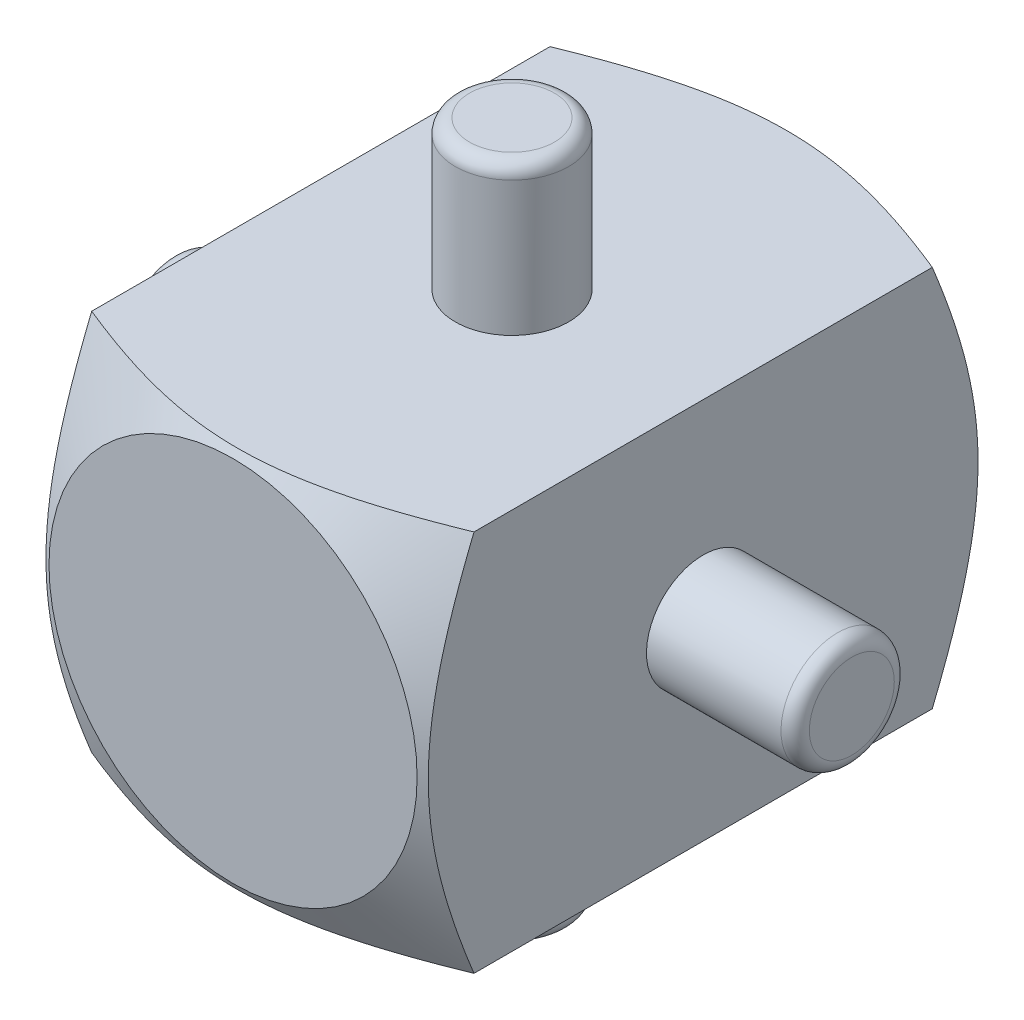
from build123d import *

# Parameters (mm, degrees)
SKETCH1_W           = 13.5
SKETCH1_H           = 13.5
BOSS_EXTRUDE1_DEPTH = 19.7
SKETCH3_R           = 2
BOSS_EXTRUDE2_DEPTH = 12
SKETCH4_R           = 2
BOSS_EXTRUDE3_DEPTH = 12
FILLET1_R           = 0.5


with BuildPart() as part:
    # Sketch1 → Boss-Extrude1 (new body)
    with BuildSketch(Plane.XY):
        Rectangle(SKETCH1_W, SKETCH1_H)
    extrude(amount=BOSS_EXTRUDE1_DEPTH)

    # Sketch2 → Cut-Revolve1 (revolve, cut)
    with BuildSketch(Plane(origin=(0, 0, 0), x_dir=(1, 0, 0), z_dir=(0, 1, 0)), mode=Mode.PRIVATE) as cut_revolve1_sk:
        Polygon((-6.5, 0), (-15.39, 0), (-15.39, -19.7), (-6.5, -19.7), (-12.85, -16.033825791), (-12.85, -3.666174209), align=None)
    revolve(cut_revolve1_sk.sketch.rotate(Axis((0, 0, 20.715268644), (0, 0, -1)), 180), axis=Axis((0, 0, 20.715268644), (0, 0, -1)), mode=Mode.SUBTRACT)

    # Sketch3 → Boss-Extrude2 (add, symmetric)
    with BuildSketch(Plane(origin=(0, 0, 0), x_dir=(1, 0, 0), z_dir=(0, 1, 0))):
        with Locations(Location((0, -9.85, 0), (0, 0, 90))):
            Circle(SKETCH3_R)
    extrude(amount=BOSS_EXTRUDE2_DEPTH, both=True)

    # Sketch4 → Boss-Extrude3 (add, symmetric)
    with BuildSketch(Plane(origin=(0, 0, 0), x_dir=(0, 0, -1), z_dir=(1, 0, 0))):
        with Locations(Location((-9.85, 0, 0), (0, 0, 270))):
            Circle(SKETCH4_R)
    extrude(amount=BOSS_EXTRUDE3_DEPTH, both=True)

    # Fillet1
    fillet1_edges = [part.edges().sort_by_distance(p)[0] for p in [
        (0, -12, 11.85),
        (0, 12, 11.85),
        (-12, 2, 9.85),
        (12, 2, 9.85),
    ]]
    fillet(fillet1_edges, radius=FILLET1_R)


solid = part.part
